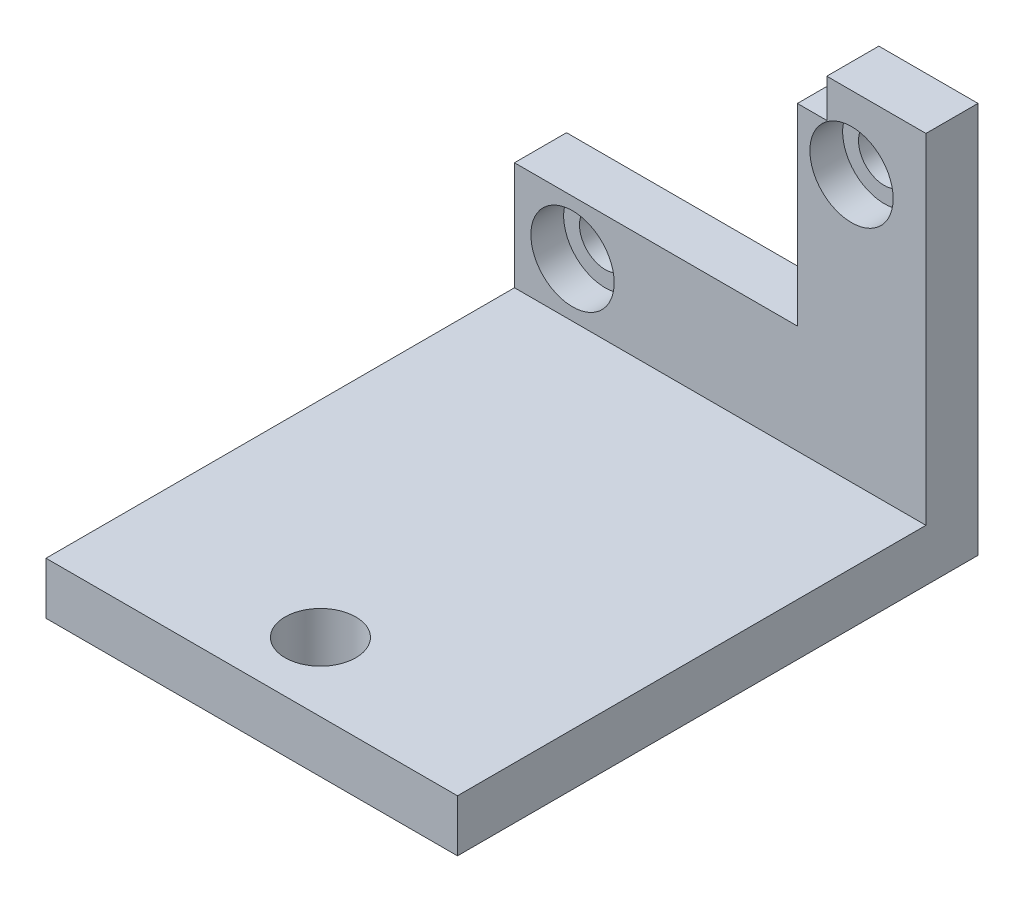
from build123d import *

# Parameters (mm, degrees)
SKETCH2_R           = 1.5748
SKETCH2_W           = 1
SKETCH2_H           = 6.604
BOSS_EXTRUDE1_DEPTH = 3.175
SKETCH3_W           = 25.098
SKETCH3_H           = 3.175
BOSS_EXTRUDE3_DEPTH = 31.75
SKETCH4_R           = 2.159
CUT_EXTRUDE1_DEPTH  = 42.7555469
SKETCH5_R           = 2.54
CUT_EXTRUDE2_DEPTH  = 2


with BuildPart() as part:
    # Sketch2 → Boss-Extrude1 (new body)
    # profile 1 of 2: a face of its own
    with BuildSketch(Plane.XY):
        Polygon((4.395213829, 10.321811953), (4.395213829, 7.827388121), (4.395213829, -1.438404904), (-11.860786171, -1.438404904), (-11.860786171, -8.042404904), (12.237213829, -8.042404904), (12.237213829, 12.658595096), (7.697213829, 12.658595096), (6.188170382, 12.658595096), (6.188170382, 10.321811953), align=None)
        with Locations((-9.320786171, -4.740404904)):
            Circle(SKETCH2_R, mode=Mode.SUBTRACT)
        with Locations((7.697213829, 8.213595096)):
            Circle(SKETCH2_R, mode=Mode.SUBTRACT)
    # profile 2 of 2: a face of its own
    with BuildSketch(Plane.XY):
        with Locations((-12.360786171, -4.740404904)):
            Rectangle(SKETCH2_W, SKETCH2_H)
    extrude(amount=BOSS_EXTRUDE1_DEPTH)

    # Sketch3 → Boss-Extrude3 (add)
    with BuildSketch(Plane(origin=(0, 0, 0), x_dir=(-1, 0, 0), z_dir=(0, 0, -1))):
        with Locations((0.311786171, -9.629904904)):
            Rectangle(SKETCH3_W, SKETCH3_H)
    extrude(amount=-BOSS_EXTRUDE3_DEPTH)

    # Sketch4 → Cut-Extrude1 (cut, through all)
    with BuildSketch(Plane.XZ.offset(11.217404904)):
        with Locations(Location((-0.311786171, 27.559, 0), (0, 0, 270))):
            Circle(SKETCH4_R)
    extrude(amount=-CUT_EXTRUDE1_DEPTH, mode=Mode.SUBTRACT)

    # Sketch5 → Cut-Extrude2 (cut)
    with BuildSketch(Plane.XY.offset(3.175)):
        with Locations((7.697213829, 8.213595096)):
            Circle(SKETCH5_R)
        with Locations((-9.320786171, -4.740404904)):
            Circle(SKETCH5_R)
    extrude(amount=-CUT_EXTRUDE2_DEPTH, mode=Mode.SUBTRACT)


solid = part.part
